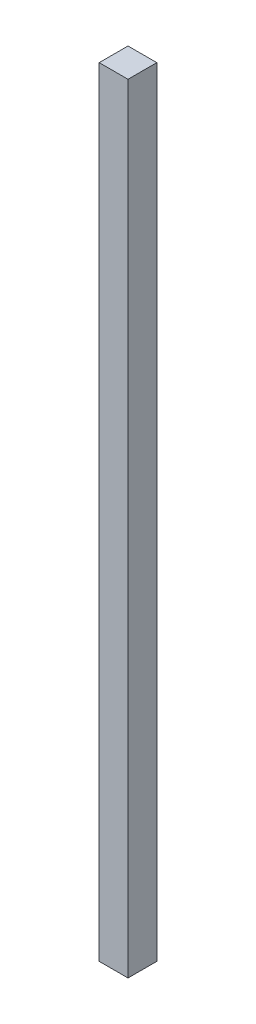
from build123d import *

# Parameters (mm, degrees)
SKETCH1_W           = 88.9
SKETCH1_H           = 88.9
BOSS_EXTRUDE1_DEPTH = 2401.8875


with BuildPart() as part:
    # Sketch1 → Boss-Extrude1 (new body)
    with BuildSketch(Plane(origin=(0, 0, 0), x_dir=(1, 0, 0), z_dir=(0, 1, 0))):
        Rectangle(SKETCH1_W, SKETCH1_H)
    extrude(amount=BOSS_EXTRUDE1_DEPTH)


solid = part.part
